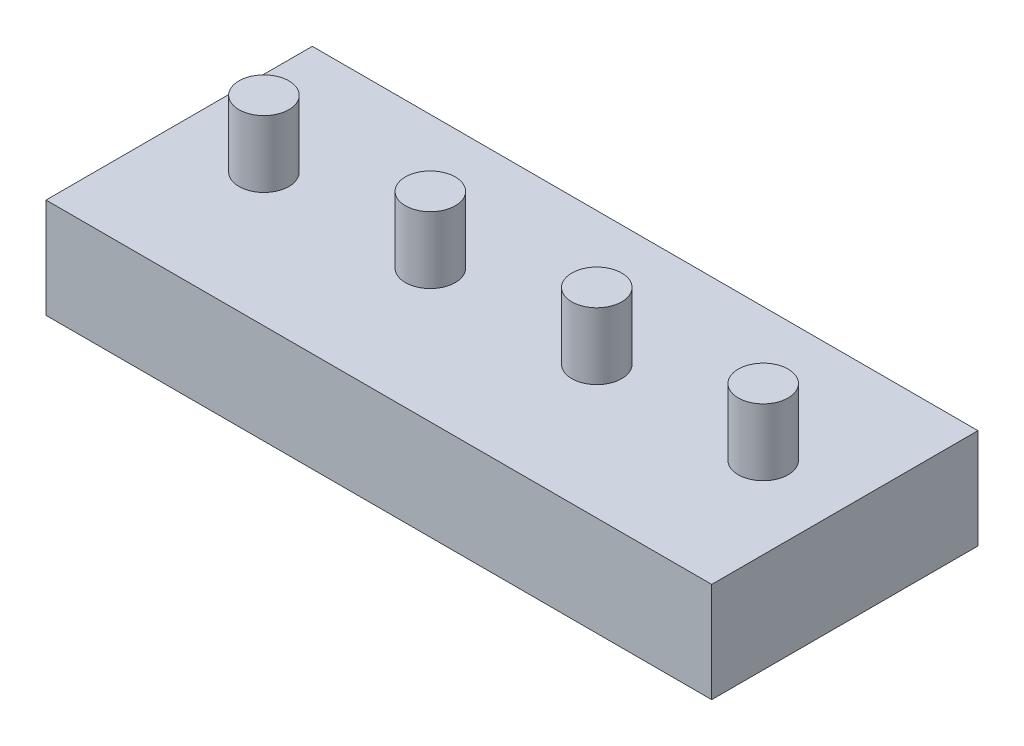
from build123d import *

# Parameters (mm, degrees)
SKETCH1_W             = 20
SKETCH1_H             = 8
BOSS_EXTRUDE1_DEPTH   = 3
SKETCH2_R             = 0.75
BOSS_EXTRUDE2_DEPTH   = 5
BOSS_EXTRUDE2_2_DEPTH = 5
BOSS_EXTRUDE2_3_DEPTH = 5
BOSS_EXTRUDE2_4_DEPTH = 5


with BuildPart() as part:
    # Sketch1 → Boss-Extrude1 (new body)
    with BuildSketch(Plane(origin=(0, 0, 0), x_dir=(1, 0, 0), z_dir=(0, 1, 0))):
        with Locations((-0.046747686, 0)):
            Rectangle(SKETCH1_W, SKETCH1_H)
    extrude(amount=BOSS_EXTRUDE1_DEPTH)


with BuildPart() as body_2:
    # Sketch2 → Boss-Extrude2 (new body)
    with BuildSketch(Plane(origin=(0, 0, 0), x_dir=(1, 0, 0), z_dir=(0, 1, 0))):
        with Locations(Location((-7.5, 0, 0), (0, 0, 270))):
            Circle(SKETCH2_R)
    extrude(amount=BOSS_EXTRUDE2_DEPTH)


with BuildPart() as body_3:
    # Sketch2 → Boss-Extrude2 2 (new body)
    with BuildSketch(Plane(origin=(0, 0, 0), x_dir=(1, 0, 0), z_dir=(0, 1, 0))):
        with Locations(Location((-2.5, 0, 0), (0, 0, 270))):
            Circle(SKETCH2_R)
    extrude(amount=BOSS_EXTRUDE2_2_DEPTH)


with BuildPart() as body_4:
    # Sketch2 → Boss-Extrude2 3 (new body)
    with BuildSketch(Plane(origin=(0, 0, 0), x_dir=(1, 0, 0), z_dir=(0, 1, 0))):
        with Locations(Location((2.5, 0, 0), (0, 0, 270))):
            Circle(SKETCH2_R)
    extrude(amount=BOSS_EXTRUDE2_3_DEPTH)


with BuildPart() as body_5:
    # Sketch2 → Boss-Extrude2 4 (new body)
    with BuildSketch(Plane(origin=(0, 0, 0), x_dir=(1, 0, 0), z_dir=(0, 1, 0))):
        with Locations(Location((7.5, 0, 0), (0, 0, 270))):
            Circle(SKETCH2_R)
    extrude(amount=BOSS_EXTRUDE2_4_DEPTH)


solid = Compound([part.part, body_2.part, body_3.part, body_4.part, body_5.part])
